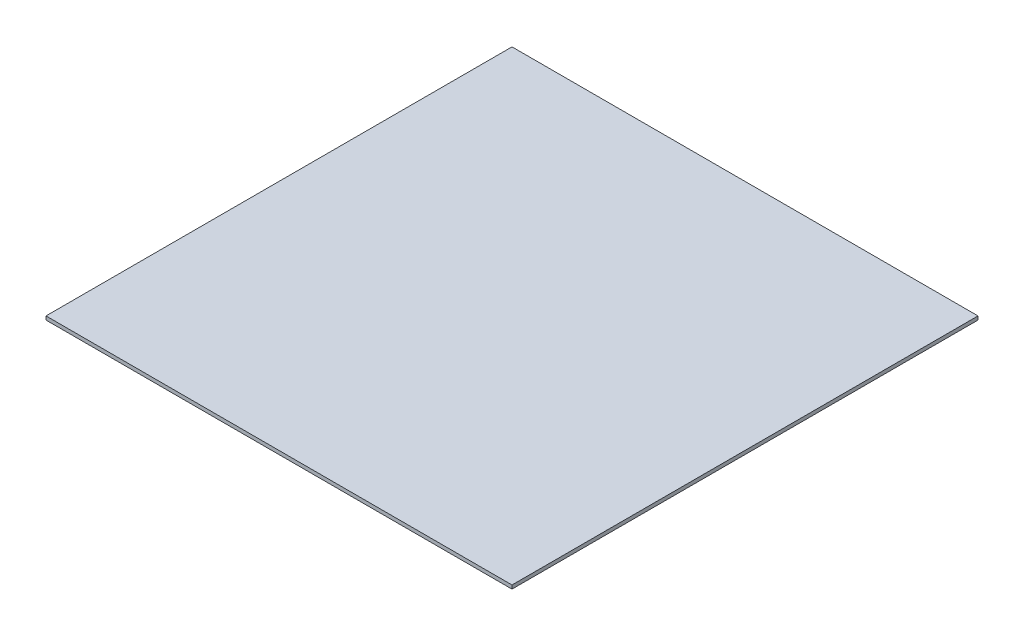
from build123d import *

# Parameters (mm, degrees)
SKETCH1_W           = 114.3
SKETCH1_H           = 114.3
BOSS_EXTRUDE1_DEPTH = 0.889


with BuildPart() as part:
    # Sketch1 → Boss-Extrude1 (new body)
    with BuildSketch(Plane(origin=(0, 0, 0), x_dir=(1, 0, 0), z_dir=(0, 1, 0))):
        with Locations((-26.758092486, 8.589017341)):
            Rectangle(SKETCH1_W, SKETCH1_H)
    extrude(amount=BOSS_EXTRUDE1_DEPTH)


solid = part.part
